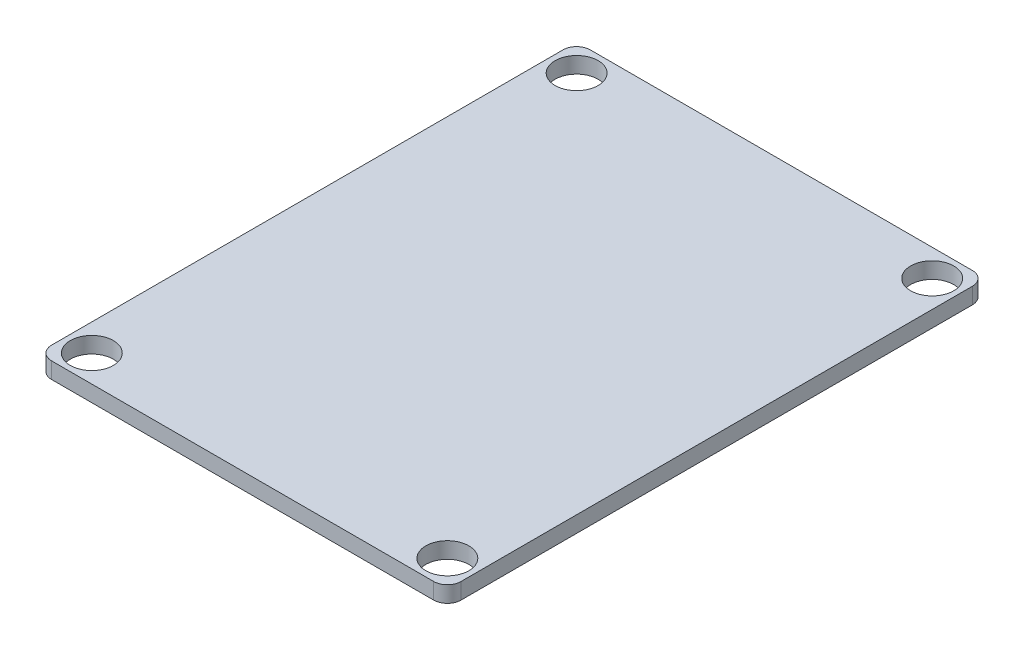
from build123d import *

# Parameters (mm, degrees)
SKETCH1_W           = 76
SKETCH1_H           = 100
BOSS_EXTRUDE1_DEPTH = 1.5
FILLET1_R           = 2.54
SKETCH2_R           = 4
CUT_EXTRUDE1_DEPTH  = 63.872887638


with BuildPart() as part:
    # Sketch1 → Boss-Extrude1 (new, symmetric)
    with BuildSketch(Plane(origin=(0, 0, 0), x_dir=(1, 0, 0), z_dir=(0, 1, 0))):
        Rectangle(SKETCH1_W, SKETCH1_H)
    extrude(amount=BOSS_EXTRUDE1_DEPTH, both=True)

    # Fillet1
    fillet1_edges = [part.edges().sort_by_distance(p)[0] for p in [
        (38, 0, 50),
        (-38, 0, 50),
        (-38, 0, -50),
        (38, 0, -50),
    ]]
    fillet(fillet1_edges, radius=FILLET1_R)

    # Sketch2 → Cut-Extrude1 (cut, through all)
    with BuildSketch(Plane(origin=(0, 1.5, 0), x_dir=(1, 0, 0), z_dir=(0, 1, 0))):
        with Locations(Location((-33, 45, 0), (0, 0, 270))):
            Circle(SKETCH2_R)
        with Locations(Location((33, 45, 0), (0, 0, 270))):
            Circle(SKETCH2_R)
        with Locations(Location((33, -45, 0), (0, 0, 270))):
            Circle(SKETCH2_R)
        with Locations(Location((-33, -45, 0), (0, 0, 270))):
            Circle(SKETCH2_R)
    extrude(amount=-CUT_EXTRUDE1_DEPTH, mode=Mode.SUBTRACT)


solid = part.part
